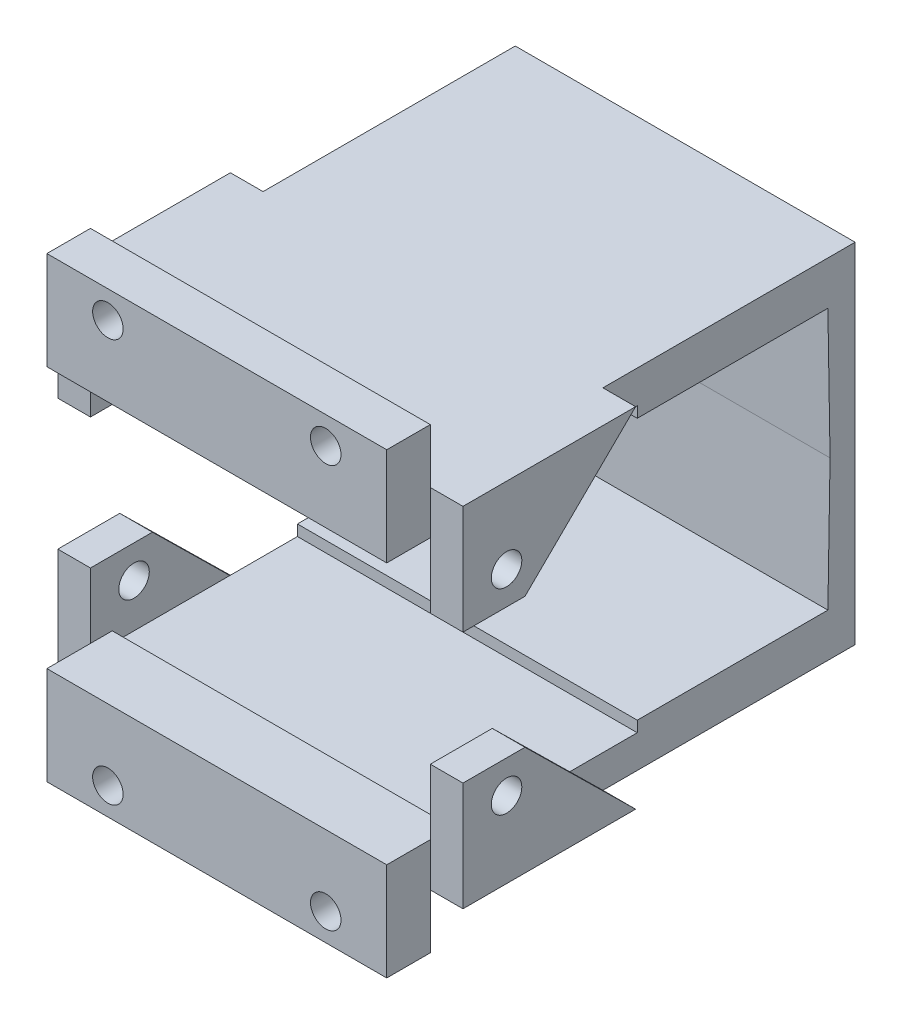
from build123d import *

# Parameters (mm, degrees)
EXTRUDE_1_DEPTH      = 2
EXTRUDE_1_DEPTH_BACK = 1
SKETCH_1_W           = 31.2
SKETCH_1_H           = 24
EXTRUDE_2_DEPTH      = 36
EXTRUDE_2_DEPTH_BACK = 3
SKETCH_2_W           = 31.2
SKETCH_2_H           = 4
SKETCH_3_R           = 1.4
EXTRUDE_3_DEPTH      = 3
SKETCH_4_R           = 1.4
CUT_EXTRUDE_1_DEPTH  = 8
SKETCH_5_W           = 17
SKETCH_5_H           = 1
CUT_EXTRUDE_2_DEPTH  = 31.2
CUT_EXTRUDE_3_DEPTH  = 31.2
SKETCH_7_R           = 1.4
EXTRUDE_4_DEPTH      = 4


with BuildPart() as part:
    # 草图1 → 凸台-拉伸1 (new, two sides: drawn at the far end of the back side and taken through both)
    with BuildSketch(Plane.XY.offset(-EXTRUDE_1_DEPTH_BACK)):
        Rectangle(SKETCH_1_W, SKETCH_1_H)
    extrude(amount=EXTRUDE_1_DEPTH + EXTRUDE_1_DEPTH_BACK)

    # 草图2 → 凸台-拉伸2 (add, two sides: drawn at the far end of the back side and taken through both)
    with BuildSketch(Plane.XY.offset(2).offset(-EXTRUDE_2_DEPTH_BACK)):
        with Locations((0, 14)):
            Rectangle(SKETCH_2_W, SKETCH_2_H)
        with Locations((0, -14)):
            Rectangle(SKETCH_2_W, SKETCH_2_H)
    extrude(amount=EXTRUDE_2_DEPTH + EXTRUDE_2_DEPTH_BACK)

    # 草图3 → 凸台-拉伸3 (add)
    # profile 1 of 2: a face of its own
    with BuildSketch(Plane.ZY.offset(15.6)):
        Polygon((38, 16), (31, 16), (22.152932489, 16), (32.310715372, 6), (38, 6), align=None)
        with Locations((34, 9)):
            Circle(SKETCH_3_R, mode=Mode.SUBTRACT)
    # profile 2 of 2: a face of its own
    with BuildSketch(Plane.ZY.offset(15.6)):
        Polygon((38, -16), (38, -6), (32.310715372, -6), (22.152932489, -16), (31, -16), align=None)
        with Locations(Location((34, -9, 0), (0, 0, 180))):
            Circle(SKETCH_3_R, mode=Mode.SUBTRACT)
    extrude_3 = extrude(amount=EXTRUDE_3_DEPTH)

    # 草图4 → 切除-拉伸1 (cut)
    with BuildSketch(Plane(origin=(0, 0, -1), x_dir=(-1, 0, 0), z_dir=(0, 0, -1))):
        with Locations((13.6, -14)):
            Circle(SKETCH_4_R)
        with Locations(Location((13.6, 14, 0), (0, 0, 180))):
            Circle(SKETCH_4_R)
        with Locations(Location((-13.6, -14, 0), (0, 0, 180))):
            Circle(SKETCH_4_R)
        with Locations((-13.6, 14)):
            Circle(SKETCH_4_R)
    extrude(amount=-CUT_EXTRUDE_1_DEPTH, mode=Mode.SUBTRACT)

    # 镜向1: 凸台-拉伸3 across plane
    add(extrude_3.mirror(Plane(origin=(0, 0, 0), x_dir=(0, 0, 1), z_dir=(1, 0, 0))))

    # 草图5 → 切除-拉伸2 (cut)
    with BuildSketch(Plane.ZY.offset(15.6)):
        with Locations((27.5, 12.5)):
            Rectangle(SKETCH_5_W, SKETCH_5_H)
        with Locations((27.5, -12.5)):
            Rectangle(SKETCH_5_W, SKETCH_5_H)
    extrude(amount=-CUT_EXTRUDE_2_DEPTH, mode=Mode.SUBTRACT)

    # 草图6 → 切除-拉伸3 (cut)
    with BuildSketch(Plane.ZY.offset(15.6)):
        Polygon((1.3, 0), (1.5, 12), (2, 12), (2, -12), (1.5, -12), align=None)
    extrude(amount=-CUT_EXTRUDE_3_DEPTH, mode=Mode.SUBTRACT)

    # 草图7 → 凸台-拉伸4 (add)
    # profile 1 of 2: a face of its own
    with BuildSketch(Plane.XY.offset(38)):
        Polygon((-15.6, 12), (15.6, 12), (15.6, 16), (15.6, 21), (-15.6, 21), (-15.6, 16), align=None)
        with Locations((-10, 18.5)):
            Circle(SKETCH_7_R, mode=Mode.SUBTRACT)
        with Locations(Location((10, 18.5, 0), (0, 0, 180))):
            Circle(SKETCH_7_R, mode=Mode.SUBTRACT)
    # profile 2 of 2: a face of its own
    with BuildSketch(Plane.XY.offset(38)):
        Polygon((-15.6, -16), (-15.6, -21), (15.6, -21), (15.6, -16), (15.6, -12), (-15.6, -12), align=None)
        with Locations((10, -18.5)):
            Circle(SKETCH_7_R, mode=Mode.SUBTRACT)
        with Locations(Location((-10, -18.5, 0), (0, 0, 180))):
            Circle(SKETCH_7_R, mode=Mode.SUBTRACT)
    extrude(amount=EXTRUDE_4_DEPTH)


solid = part.part
